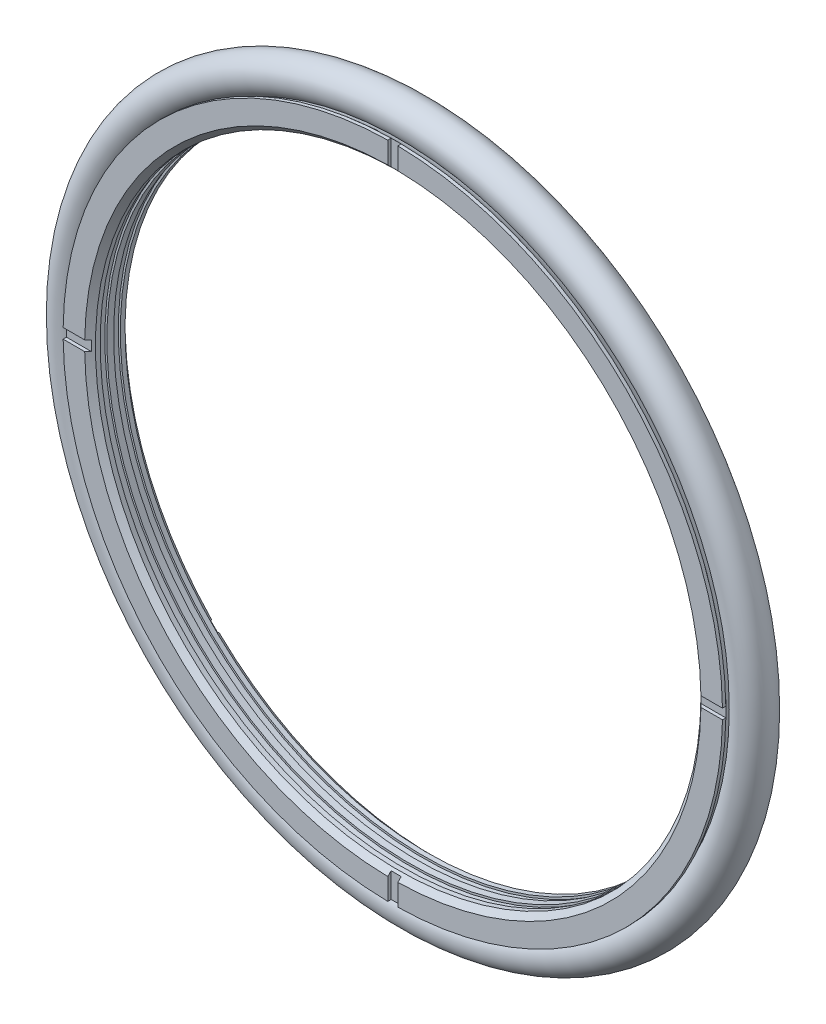
from build123d import *

# Parameters (mm, degrees)
SKETCH4_W          = 1.5
SKETCH4_H          = 6.449772914
CUT_EXTRUDE1_DEPTH = 0.5
CUT_EXTRUDE2_DEPTH = 0.5
CIRPATTERN1_COUNT  = 4
SKETCH2_R          = 2.65


with BuildPart() as part:
    # Sketch1 → Revolve1 (revolve)
    with BuildSketch(Plane(origin=(0, 0, 0), x_dir=(0, 0, -1), z_dir=(1, 0, 0)), mode=Mode.PRIVATE) as revolve1_sk:
        with BuildLine():
            Line((-2.2, 45), (-1.5, 45))
            Line((-1.5, 45), (-1.5, 45.3))
            Line((-1.5, 45.3), (-0.5, 45.3))
            Line((-0.5, 45.3), (-0.5, 45))
            Line((-0.5, 45), (0.5, 45))
            Line((0.5, 45), (0.5, 45.3))
            Line((0.5, 45.3), (1.5, 45.3))
            Line((1.5, 45.3), (1.5, 45))
            Line((1.5, 45), (2.2, 45))
            Line((2.2, 45), (3, 45.8))
            Line((3, 45.8), (3, 49))
            Line((3, 49), (2.5, 49))
            ThreePointArc((2.5, 49), (0, 47.703720497), (-2.5, 49))
            Line((-2.5, 49), (-3, 49))
            Line((-3, 49), (-3, 45.8))
            Line((-3, 45.8), (-2.2, 45))
        make_face()
    revolve(revolve1_sk.sketch.rotate(Axis((0, 0, 0), (0, 0, -1)), 90), axis=Axis((0, 0, 0), (0, 0, -1)))

    # Sketch4 → Cut-Extrude1 (cut)
    with BuildSketch(Plane.XY.offset(3)):
        with Locations((0, 47.20188555)):
            Rectangle(SKETCH4_W, SKETCH4_H)
    cut_extrude1 = extrude(amount=-CUT_EXTRUDE1_DEPTH, mode=Mode.SUBTRACT)

    # Sketch5 → Cut-Extrude2 (cut)
    with BuildSketch(Plane(origin=(0, 0, -3), x_dir=(-1, 0, 0), z_dir=(0, 0, -1))):
        Polygon((36.922611769, 35.861951597), (35.861951597, 36.922611769), (28.244140765, 29.304800937), (29.304800937, 28.244140765), align=None)
    cut_extrude2 = extrude(amount=-CUT_EXTRUDE2_DEPTH, mode=Mode.SUBTRACT)

    # CirPattern1: Cut-Extrude1, Cut-Extrude2 ×4 about axis
    cirpattern1_axis = Axis((0, 0, 0), (0, 0, 1))
    add([cut_extrude1.rotate(cirpattern1_axis, i * 360 / CIRPATTERN1_COUNT) for i in range(1, CIRPATTERN1_COUNT)], mode=Mode.SUBTRACT)
    add([cut_extrude2.rotate(cirpattern1_axis, i * 360 / CIRPATTERN1_COUNT) for i in range(1, CIRPATTERN1_COUNT)], mode=Mode.SUBTRACT)


with BuildPart() as body_2:
    # Sketch2 → Revolve2 (revolve)
    with BuildSketch(Plane(origin=(0, 0, 0), x_dir=(0, 0, -1), z_dir=(1, 0, 0)), mode=Mode.PRIVATE) as revolve2_sk:
        with Locations((0, 50.75)):
            Circle(SKETCH2_R)
    revolve(revolve2_sk.sketch.rotate(Axis((0, 0, 0), (0, 0, -1)), 314.051351036), axis=Axis((0, 0, 0), (0, 0, -1)))


solid = Compound([part.part, body_2.part])
